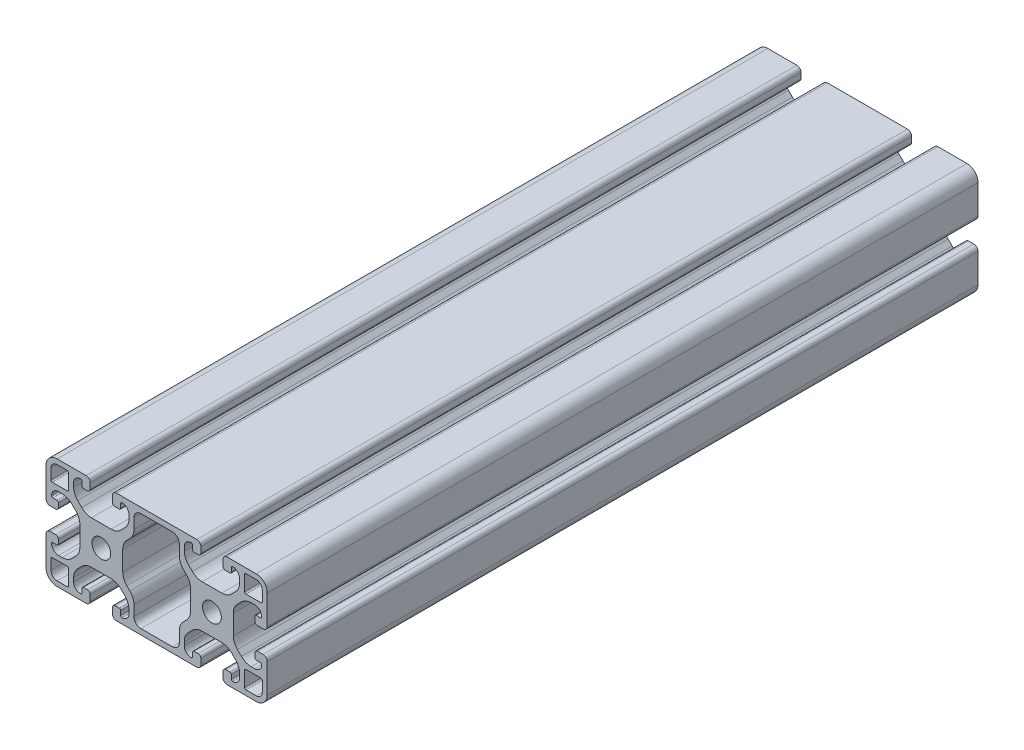
from build123d import *

# Parameters (mm, degrees)
ESQUISSE1_R        = 3.4
BOSS_EXTRU_1_DEPTH = 257


with BuildPart() as part:
    # Esquisse1 → Boss.-Extru.1 (new body)
    with BuildSketch(Plane.XY.offset(20)):
        with BuildLine():
            Line((66.5, 4.5), (65, 4.5))
            ThreePointArc((65, 4.5), (64.292893219, 4.207106781), (64, 3.5))
            Line((64, 3.5), (64, 1.5))
            ThreePointArc((64, 1.5), (64.439339828, 0.439339828), (65.5, 0))
            Line((65.5, 0), (76, 0))
            ThreePointArc((76, 0), (78.828427125, 1.171572875), (80, 4))
            Line((80, 4), (80, 14.5))
            ThreePointArc((80, 14.5), (79.560660172, 15.560660172), (78.5, 16))
            Line((78.5, 16), (76.5, 16))
            ThreePointArc((76.5, 16), (75.792893219, 15.707106781), (75.5, 15))
            Line((75.5, 15), (75.5, 13.5))
            ThreePointArc((75.5, 13.5), (75.646446609, 13.146446609), (76, 13))
            Line((76, 13), (77.5, 13))
            ThreePointArc((77.5, 13), (77.853553391, 12.853553391), (78, 12.5))
            ThreePointArc((78, 12.5), (77.267766953, 10.732233047), (75.5, 10))
            Line((75.5, 10), (74.192388155, 10))
            ThreePointArc((74.192388155, 10), (72.278970994, 10.380602337), (70.656854249, 11.464466094))
            Line((70.656854249, 11.464466094), (69.214466094, 12.906854249))
            ThreePointArc((69.214466094, 12.906854249), (68.130602337, 14.528970994), (67.75, 16.442388155))
            Line((67.75, 16.442388155), (67.75, 23.557611845))
            ThreePointArc((67.75, 23.557611845), (68.130602337, 25.471029006), (69.214466094, 27.093145751))
            Line((69.214466094, 27.093145751), (70.656854249, 28.535533906))
            ThreePointArc((70.656854249, 28.535533906), (72.278970994, 29.619397663), (74.192388155, 30))
            Line((74.192388155, 30), (75.5, 30))
            ThreePointArc((75.5, 30), (77.267766953, 29.267766953), (78, 27.5))
            ThreePointArc((78, 27.5), (77.853553391, 27.146446609), (77.5, 27))
            Line((77.5, 27), (76, 27))
            ThreePointArc((76, 27), (75.646446609, 26.853553391), (75.5, 26.5))
            Line((75.5, 26.5), (75.5, 25))
            ThreePointArc((75.5, 25), (75.792893219, 24.292893219), (76.5, 24))
            Line((76.5, 24), (78.5, 24))
            ThreePointArc((78.5, 24), (79.560660172, 24.439339828), (80, 25.5))
            Line((80, 25.5), (80, 36))
            ThreePointArc((80, 36), (78.828427125, 38.828427125), (76, 40))
            Line((76, 40), (65.5, 40))
            ThreePointArc((65.5, 40), (64.439339828, 39.560660172), (64, 38.5))
            Line((64, 38.5), (64, 36.5))
            ThreePointArc((64, 36.5), (64.292893219, 35.792893219), (65, 35.5))
            Line((65, 35.5), (66.5, 35.5))
            ThreePointArc((66.5, 35.5), (66.853553391, 35.646446609), (67, 36))
            Line((67, 36), (67, 37.5))
            ThreePointArc((67, 37.5), (67.146446609, 37.853553391), (67.5, 38))
            ThreePointArc((67.5, 38), (69.267766953, 37.267766953), (70, 35.5))
            Line((70, 35.5), (70, 34.192388155))
            ThreePointArc((70, 34.192388155), (69.619397663, 32.278970994), (68.535533906, 30.656854249))
            Line((68.535533906, 30.656854249), (67.093145751, 29.214466094))
            ThreePointArc((67.093145751, 29.214466094), (65.471029006, 28.130602337), (63.557611845, 27.75))
            Line((63.557611845, 27.75), (56.442388155, 27.75))
            ThreePointArc((56.442388155, 27.75), (54.528970994, 28.130602337), (52.906854249, 29.214466094))
            Line((52.906854249, 29.214466094), (51.464466094, 30.656854249))
            ThreePointArc((51.464466094, 30.656854249), (50.380602337, 32.278970994), (50, 34.192388155))
            Line((50, 34.192388155), (50, 35.5))
            ThreePointArc((50, 35.5), (50.732233047, 37.267766953), (52.5, 38))
            ThreePointArc((52.5, 38), (52.853553391, 37.853553391), (53, 37.5))
            Line((53, 37.5), (53, 36))
            ThreePointArc((53, 36), (53.146446609, 35.646446609), (53.5, 35.5))
            Line((53.5, 35.5), (55, 35.5))
            ThreePointArc((55, 35.5), (55.707106781, 35.792893219), (56, 36.5))
            Line((56, 36.5), (56, 38.5))
            ThreePointArc((56, 38.5), (55.560660172, 39.560660172), (54.5, 40))
            Line((54.5, 40), (25.5, 40))
            ThreePointArc((25.5, 40), (24.439339828, 39.560660172), (24, 38.5))
            Line((24, 38.5), (24, 36.5))
            ThreePointArc((24, 36.5), (24.292893219, 35.792893219), (25, 35.5))
            Line((25, 35.5), (26.5, 35.5))
            ThreePointArc((26.5, 35.5), (26.853553391, 35.646446609), (27, 36))
            Line((27, 36), (27, 37.5))
            ThreePointArc((27, 37.5), (27.146446609, 37.853553391), (27.5, 38))
            ThreePointArc((27.5, 38), (29.267766953, 37.267766953), (30, 35.5))
            Line((30, 35.5), (30, 34.192388155))
            ThreePointArc((30, 34.192388155), (29.619397663, 32.278970994), (28.535533906, 30.656854249))
            Line((28.535533906, 30.656854249), (27.093145751, 29.214466094))
            ThreePointArc((27.093145751, 29.214466094), (25.471029006, 28.130602337), (23.557611845, 27.75))
            Line((23.557611845, 27.75), (16.442388155, 27.75))
            ThreePointArc((16.442388155, 27.75), (14.528970994, 28.130602337), (12.906854249, 29.214466094))
            Line((12.906854249, 29.214466094), (11.464466094, 30.656854249))
            ThreePointArc((11.464466094, 30.656854249), (10.380602337, 32.278970994), (10, 34.192388155))
            Line((10, 34.192388155), (10, 35.5))
            ThreePointArc((10, 35.5), (10.732233047, 37.267766953), (12.5, 38))
            ThreePointArc((12.5, 38), (12.853553391, 37.853553391), (13, 37.5))
            Line((13, 37.5), (13, 36))
            ThreePointArc((13, 36), (13.146446609, 35.646446609), (13.5, 35.5))
            Line((13.5, 35.5), (15, 35.5))
            ThreePointArc((15, 35.5), (15.707106781, 35.792893219), (16, 36.5))
            Line((16, 36.5), (16, 38.5))
            ThreePointArc((16, 38.5), (15.560660172, 39.560660172), (14.5, 40))
            Line((14.5, 40), (4, 40))
            ThreePointArc((4, 40), (1.171572875, 38.828427125), (0, 36))
            Line((0, 36), (0, 25.5))
            ThreePointArc((0, 25.5), (0.439339828, 24.439339828), (1.5, 24))
            Line((1.5, 24), (3.5, 24))
            ThreePointArc((3.5, 24), (4.207106781, 24.292893219), (4.5, 25))
            Line((4.5, 25), (4.5, 26.5))
            ThreePointArc((4.5, 26.5), (4.353553391, 26.853553391), (4, 27))
            Line((4, 27), (2.5, 27))
            ThreePointArc((2.5, 27), (2.146446609, 27.146446609), (2, 27.5))
            ThreePointArc((2, 27.5), (2.732233047, 29.267766953), (4.5, 30))
            Line((4.5, 30), (5.807611845, 30))
            ThreePointArc((5.807611845, 30), (7.721029006, 29.619397663), (9.343145751, 28.535533906))
            Line((9.343145751, 28.535533906), (10.785533906, 27.093145751))
            ThreePointArc((10.785533906, 27.093145751), (11.869397663, 25.471029006), (12.25, 23.557611845))
            Line((12.25, 23.557611845), (12.25, 16.442388155))
            ThreePointArc((12.25, 16.442388155), (11.869397663, 14.528970994), (10.785533906, 12.906854249))
            Line((10.785533906, 12.906854249), (9.343145751, 11.464466094))
            ThreePointArc((9.343145751, 11.464466094), (7.721029006, 10.380602337), (5.807611845, 10))
            Line((5.807611845, 10), (4.5, 10))
            ThreePointArc((4.5, 10), (2.732233047, 10.732233047), (2, 12.5))
            ThreePointArc((2, 12.5), (2.146446609, 12.853553391), (2.5, 13))
            Line((2.5, 13), (4, 13))
            ThreePointArc((4, 13), (4.353553391, 13.146446609), (4.5, 13.5))
            Line((4.5, 13.5), (4.5, 15))
            ThreePointArc((4.5, 15), (4.207106781, 15.707106781), (3.5, 16))
            Line((3.5, 16), (1.5, 16))
            ThreePointArc((1.5, 16), (0.439339828, 15.560660172), (0, 14.5))
            Line((0, 14.5), (0, 4))
            ThreePointArc((0, 4), (1.171572875, 1.171572875), (4, 0))
            Line((4, 0), (14.5, 0))
            ThreePointArc((14.5, 0), (15.560660172, 0.439339828), (16, 1.5))
            Line((16, 1.5), (16, 3.5))
            ThreePointArc((16, 3.5), (15.707106781, 4.207106781), (15, 4.5))
            Line((15, 4.5), (13.5, 4.5))
            ThreePointArc((13.5, 4.5), (13.146446609, 4.353553391), (13, 4))
            Line((13, 4), (13, 2.5))
            ThreePointArc((13, 2.5), (12.853553391, 2.146446609), (12.5, 2))
            ThreePointArc((12.5, 2), (10.732233047, 2.732233047), (10, 4.5))
            Line((10, 4.5), (10, 5.807611845))
            ThreePointArc((10, 5.807611845), (10.380602337, 7.721029006), (11.464466094, 9.343145751))
            Line((11.464466094, 9.343145751), (12.906854249, 10.785533906))
            ThreePointArc((12.906854249, 10.785533906), (14.528970994, 11.869397663), (16.442388155, 12.25))
            Line((16.442388155, 12.25), (23.557611845, 12.25))
            ThreePointArc((23.557611845, 12.25), (25.471029006, 11.869397663), (27.093145751, 10.785533906))
            Line((27.093145751, 10.785533906), (28.535533906, 9.343145751))
            ThreePointArc((28.535533906, 9.343145751), (29.619397663, 7.721029006), (30, 5.807611845))
            Line((30, 5.807611845), (30, 4.5))
            ThreePointArc((30, 4.5), (29.267766953, 2.732233047), (27.5, 2))
            ThreePointArc((27.5, 2), (27.146446609, 2.146446609), (27, 2.5))
            Line((27, 2.5), (27, 4))
            ThreePointArc((27, 4), (26.853553391, 4.353553391), (26.5, 4.5))
            Line((26.5, 4.5), (25, 4.5))
            ThreePointArc((25, 4.5), (24.292893219, 4.207106781), (24, 3.5))
            Line((24, 3.5), (24, 1.5))
            ThreePointArc((24, 1.5), (24.439339828, 0.439339828), (25.5, 0))
            Line((25.5, 0), (54.5, 0))
            ThreePointArc((54.5, 0), (55.560660172, 0.439339828), (56, 1.5))
            Line((56, 1.5), (56, 3.5))
            ThreePointArc((56, 3.5), (55.707106781, 4.207106781), (55, 4.5))
            Line((55, 4.5), (53.5, 4.5))
            ThreePointArc((53.5, 4.5), (53.146446609, 4.353553391), (53, 4))
            Line((53, 4), (53, 2.5))
            ThreePointArc((53, 2.5), (52.853553391, 2.146446609), (52.5, 2))
            ThreePointArc((52.5, 2), (50.732233047, 2.732233047), (50, 4.5))
            Line((50, 4.5), (50, 5.807611845))
            ThreePointArc((50, 5.807611845), (50.380602337, 7.721029006), (51.464466094, 9.343145751))
            Line((51.464466094, 9.343145751), (52.906854249, 10.785533906))
            ThreePointArc((52.906854249, 10.785533906), (54.528970994, 11.869397663), (56.442388155, 12.25))
            Line((56.442388155, 12.25), (63.557611845, 12.25))
            ThreePointArc((63.557611845, 12.25), (65.471029006, 11.869397663), (67.093145751, 10.785533906))
            Line((67.093145751, 10.785533906), (68.535533906, 9.343145751))
            ThreePointArc((68.535533906, 9.343145751), (69.619397663, 7.721029006), (70, 5.807611845))
            Line((70, 5.807611845), (70, 4.5))
            ThreePointArc((70, 4.5), (69.267766953, 2.732233047), (67.5, 2))
            ThreePointArc((67.5, 2), (67.146446609, 2.146446609), (67, 2.5))
            Line((67, 2.5), (67, 4))
            ThreePointArc((67, 4), (66.853553391, 4.353553391), (66.5, 4.5))
        make_face()
        with Locations(Location((20, 20, 0), (0, 0, 180))):
            Circle(ESQUISSE1_R, mode=Mode.SUBTRACT)
        with Locations(Location((60, 20, 0), (0, 0, 180))):
            Circle(ESQUISSE1_R, mode=Mode.SUBTRACT)
        with BuildLine():
            Line((31.8, 4.5), (31.8, 8.250252532))
            ThreePointArc((31.8, 8.250252532), (31.419397663, 10.163669694), (30.335533906, 11.785786438))
            Line((30.335533906, 11.785786438), (29.214466094, 12.906854249))
            ThreePointArc((29.214466094, 12.906854249), (28.130602337, 14.528970994), (27.75, 16.442388155))
            Line((27.75, 16.442388155), (27.75, 23.557611845))
            ThreePointArc((27.75, 23.557611845), (28.130602337, 25.471029006), (29.214466094, 27.093145751))
            Line((29.214466094, 27.093145751), (30.335533906, 28.214213562))
            ThreePointArc((30.335533906, 28.214213562), (31.419397663, 29.836330306), (31.8, 31.749747468))
            Line((31.8, 31.749747468), (31.8, 35.5))
            ThreePointArc((31.8, 35.5), (32.532233047, 37.267766953), (34.3, 38))
            Line((34.3, 38), (45.7, 38))
            ThreePointArc((45.7, 38), (47.467766953, 37.267766953), (48.2, 35.5))
            Line((48.2, 35.5), (48.2, 31.749747468))
            ThreePointArc((48.2, 31.749747468), (48.580602337, 29.836330306), (49.664466094, 28.214213562))
            Line((49.664466094, 28.214213562), (50.785533906, 27.093145751))
            ThreePointArc((50.785533906, 27.093145751), (51.869397663, 25.471029006), (52.25, 23.557611845))
            Line((52.25, 23.557611845), (52.25, 16.442388155))
            ThreePointArc((52.25, 16.442388155), (51.869397663, 14.528970994), (50.785533906, 12.906854249))
            Line((50.785533906, 12.906854249), (49.664466094, 11.785786438))
            ThreePointArc((49.664466094, 11.785786438), (48.580602337, 10.163669694), (48.2, 8.250252532))
            Line((48.2, 8.250252532), (48.2, 4.5))
            ThreePointArc((48.2, 4.5), (47.467766953, 2.732233047), (45.7, 2))
            Line((45.7, 2), (34.3, 2))
            ThreePointArc((34.3, 2), (32.532233047, 2.732233047), (31.8, 4.5))
        make_face(mode=Mode.SUBTRACT)
        with BuildLine():
            Line((7.7, 1.8), (4, 1.8))
            ThreePointArc((4, 1.8), (2.444365081, 2.444365081), (1.8, 4))
            Line((1.8, 4), (1.8, 7.7))
            ThreePointArc((1.8, 7.7), (1.946446609, 8.053553391), (2.3, 8.2))
            Line((2.3, 8.2), (7.7, 8.2))
            ThreePointArc((7.7, 8.2), (8.053553391, 8.053553391), (8.2, 7.7))
            Line((8.2, 7.7), (8.2, 2.3))
            ThreePointArc((8.2, 2.3), (8.053553391, 1.946446609), (7.7, 1.8))
        make_face(mode=Mode.SUBTRACT)
        with BuildLine():
            Line((72.3, 38.2), (76, 38.2))
            ThreePointArc((76, 38.2), (77.555634919, 37.555634919), (78.2, 36))
            Line((78.2, 36), (78.2, 32.3))
            ThreePointArc((78.2, 32.3), (78.053553391, 31.946446609), (77.7, 31.8))
            Line((77.7, 31.8), (72.3, 31.8))
            ThreePointArc((72.3, 31.8), (71.946446609, 31.946446609), (71.8, 32.3))
            Line((71.8, 32.3), (71.8, 37.7))
            ThreePointArc((71.8, 37.7), (71.946446609, 38.053553391), (72.3, 38.2))
        make_face(mode=Mode.SUBTRACT)
        with BuildLine():
            Line((78.2, 7.7), (78.2, 4))
            ThreePointArc((78.2, 4), (77.555634919, 2.444365081), (76, 1.8))
            Line((76, 1.8), (72.3, 1.8))
            ThreePointArc((72.3, 1.8), (71.946446609, 1.946446609), (71.8, 2.3))
            Line((71.8, 2.3), (71.8, 7.7))
            ThreePointArc((71.8, 7.7), (71.946446609, 8.053553391), (72.3, 8.2))
            Line((72.3, 8.2), (77.7, 8.2))
            ThreePointArc((77.7, 8.2), (78.053553391, 8.053553391), (78.2, 7.7))
        make_face(mode=Mode.SUBTRACT)
        with BuildLine():
            Line((1.8, 32.3), (1.8, 36))
            ThreePointArc((1.8, 36), (2.444365081, 37.555634919), (4, 38.2))
            Line((4, 38.2), (7.7, 38.2))
            ThreePointArc((7.7, 38.2), (8.053553391, 38.053553391), (8.2, 37.7))
            Line((8.2, 37.7), (8.2, 32.3))
            ThreePointArc((8.2, 32.3), (8.053553391, 31.946446609), (7.7, 31.8))
            Line((7.7, 31.8), (2.3, 31.8))
            ThreePointArc((2.3, 31.8), (1.946446609, 31.946446609), (1.8, 32.3))
        make_face(mode=Mode.SUBTRACT)
    extrude(amount=-BOSS_EXTRU_1_DEPTH)


solid = part.part
